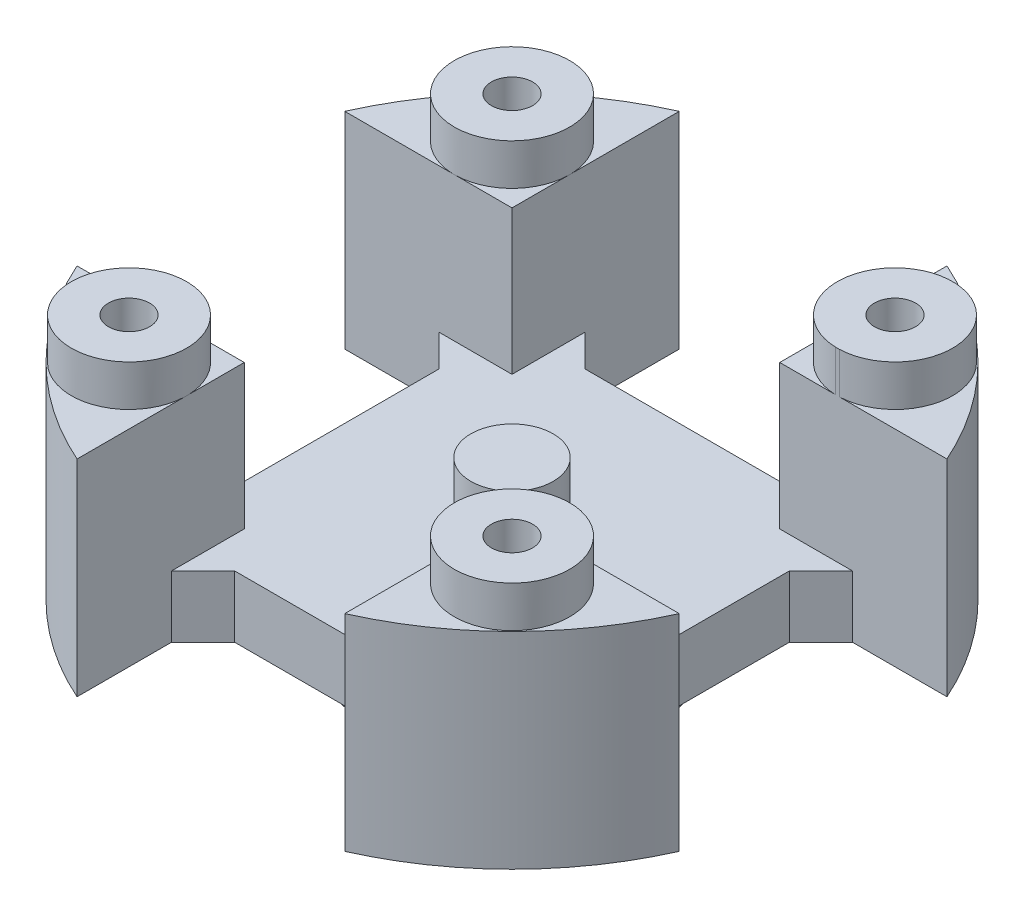
from build123d import *

# Parameters (mm, degrees)
CROQUIS1_R                 = 16
SALIENTE_EXTRUIR1_DEPTH    = 10
CORTAR_EXTRUIR2_DEPTH      = 10
CORTAR_EXTRUIR4_DEPTH      = 7
CORTAR_EXTRUIR4_DEPTH_BACK = 10
CORTAR_EXTRUIR4_START      = -10
CROQUIS5_R                 = 2
SALIENTE_EXTRUIR2_DEPTH    = 3
CROQUIS6_R                 = 2.8
CROQUIS6_R_2               = 1
SALIENTE_EXTRUIR4_DEPTH    = 2
CORTAR_EXTRUIR5_START      = -12
CROQUIS9_R                 = 1
CORTAR_EXTRUIR5_DEPTH      = 12
CROQUIS10_R                = 6.75
SALIENTE_EXTRUIR5_DEPTH    = 2
CROQUIS11_R                = 6
CORTAR_EXTRUIR6_DEPTH      = 4
CROQUIS12_R                = 0.375
CORTAR_EXTRUIR7_DEPTH      = 7


with BuildPart() as part:
    # Croquis1 → Saliente-Extruir1 (new body)
    with BuildSketch(Plane(origin=(0, 0, 0), x_dir=(1, 0, 0), z_dir=(0, 1, 0))):
        with Locations(Location((0, 0, 0), (0, 0, 270))):
            Circle(CROQUIS1_R)
    extrude(amount=SALIENTE_EXTRUIR1_DEPTH)

    # Croquis2 → Cortar-Extruir2 (cut)
    with BuildSketch(Plane(origin=(0, 0, 0), x_dir=(-1, 0, 0), z_dir=(0, -1, 0))):
        with BuildLine():
            ThreePointArc((-6.5, -14.620191518), (0, -16), (6.5, -14.620191517))
            Line((6.5, -14.620191517), (6.5, -10.035533906))
            Line((6.5, -10.035533906), (4.964466094, -8.5))
            Line((4.964466094, -8.5), (-4.964466094, -8.5))
            Line((-4.964466094, -8.5), (-6.5, -10.035533906))
            Line((-6.5, -10.035533906), (-6.5, -14.620191517))
        make_face()
        with BuildLine():
            Line((-4.964466094, 8.5), (4.964466094, 8.5))
            Line((4.964466094, 8.5), (6.5, 10.035533906))
            Line((6.5, 10.035533906), (6.5, 14.620191517))
            ThreePointArc((6.5, 14.620191518), (0, 16.000000001), (-6.5, 14.620191518))
            Line((-6.5, 14.620191517), (-6.5, 10.035533906))
            Line((-6.5, 10.035533906), (-4.964466094, 8.5))
        make_face()
        with BuildLine():
            Line((10.035533906, -6.5), (14.620191517, -6.5))
            ThreePointArc((14.620191515, -6.499999999), (15.651246979, -3.322418977), (15.999999994, 0))
            ThreePointArc((16, 0), (15.651246984, 3.322418978), (14.620191517, 6.5))
            Line((14.620191517, 6.5), (10.035533906, 6.5))
            Line((10.035533906, 6.5), (8.5, 4.964466094))
            Line((8.5, 4.964466094), (8.5, -4.964466094))
            Line((8.5, -4.964466094), (10.035533906, -6.5))
        make_face()
        with BuildLine():
            ThreePointArc((-14.620191518, 6.5), (-16.000000001, 0), (-14.620191518, -6.5))
            Line((-14.620191517, -6.5), (-10.035533906, -6.5))
            Line((-10.035533906, -6.5), (-8.5, -4.964466094))
            Line((-8.5, -4.964466094), (-8.5, 4.964466094))
            Line((-8.5, 4.964466094), (-10.035533906, 6.5))
            Line((-10.035533906, 6.5), (-14.620191517, 6.5))
        make_face()
    extrude(amount=-CORTAR_EXTRUIR2_DEPTH, mode=Mode.SUBTRACT)

    # Croquis4 → Cortar-Extruir4 (cut, two sides: drawn at the far end of the back side and taken through both)
    with BuildSketch(Plane.XZ.offset(CORTAR_EXTRUIR4_START - CORTAR_EXTRUIR4_DEPTH_BACK)):
        Polygon((-6.5, 16.599431938), (-6.5, 6.5), (-19.32076002, 6.5), (-19.32076002, -6.5), (-6.5, -6.5), (-6.5, -17.296221808), (6.5, -17.296221808), (6.5, -6.5), (20.964302933, -6.5), (20.964302933, 6.5), (6.5, 6.5), (6.5, 16.599431938), align=None)
    extrude(amount=CORTAR_EXTRUIR4_DEPTH + CORTAR_EXTRUIR4_DEPTH_BACK, mode=Mode.SUBTRACT)

    # Croquis5 → Saliente-Extruir2 (add)
    with BuildSketch(Plane(origin=(0, 3, 0), x_dir=(1, 0, 0), z_dir=(0, 1, 0))):
        with Locations(Location((0, 0, 0), (0, 0, 270))):
            Circle(CROQUIS5_R)
    extrude(amount=SALIENTE_EXTRUIR2_DEPTH)

    # Croquis6 → Saliente-Extruir4 (add)
    # profile 1 of 4: a face of its own
    with BuildSketch(Plane(origin=(0, 10, 0), x_dir=(1, 0, 0), z_dir=(0, 1, 0))):
        with Locations(Location((-9.298454173, -9.298454173, 0), (0, 0, 88.096034402))):
            Circle(CROQUIS6_R)
        with Locations(Location((-9.298454173, -9.298454173, 0), (0, 0, 270))):
            Circle(CROQUIS6_R_2, mode=Mode.SUBTRACT)
    # profile 2 of 4: a face of its own
    with BuildSketch(Plane(origin=(0, 10, 0), x_dir=(1, 0, 0), z_dir=(0, 1, 0))):
        with Locations(Location((-9.298454173, 9.298454173, 0), (0, 0, 1.903965598))):
            Circle(CROQUIS6_R)
        with Locations(Location((-9.298454173, 9.298454173, 0), (0, 0, 270))):
            Circle(CROQUIS6_R_2, mode=Mode.SUBTRACT)
    # profile 3 of 4: a face of its own
    with BuildSketch(Plane(origin=(0, 10, 0), x_dir=(1, 0, 0), z_dir=(0, 1, 0))):
        with BuildLine():
            ThreePointArc((9.391482361, 6.5), (11.310974847, 7.351723442), (12.098454173, 9.298454173))
            ThreePointArc((12.098454173, 9.298454173), (9.344974688, 12.098067689), (6.5, 9.391482361))
            Line((6.5, 9.391482361), (6.5, 9.205425984))
            ThreePointArc((6.5, 9.205425984), (7.318555185, 7.318555185), (9.205425984, 6.5))
            Line((9.205425984, 6.5), (9.391482361, 6.5))
        make_face()
        with Locations(Location((9.298454173, 9.298454173, 0), (0, 0, 270))):
            Circle(CROQUIS6_R_2, mode=Mode.SUBTRACT)
    # profile 4 of 4: a face of its own
    with BuildSketch(Plane(origin=(0, 10, 0), x_dir=(1, 0, 0), z_dir=(0, 1, 0))):
        with Locations(Location((9.298454173, -9.298454173, 0), (0, 0, 91.903965598))):
            Circle(CROQUIS6_R)
        with Locations(Location((9.298454173, -9.298454173, 0), (0, 0, 270))):
            Circle(CROQUIS6_R_2, mode=Mode.SUBTRACT)
    extrude(amount=SALIENTE_EXTRUIR4_DEPTH)

    # Croquis9 → Cortar-Extruir5 (cut)
    with BuildSketch(Plane(origin=(0, 10, 0), x_dir=(1, 0, 0), z_dir=(0, 1, 0)).offset(CORTAR_EXTRUIR5_START)):
        with Locations(Location((-9.298454173, 9.298454173, 0), (0, 0, 270))):
            Circle(CROQUIS9_R)
        with Locations(Location((9.298454173, 9.298454173, 0), (0, 0, 270))):
            Circle(CROQUIS9_R)
        with Locations(Location((9.298454173, -9.298454173, 0), (0, 0, 270))):
            Circle(CROQUIS9_R)
        with Locations(Location((-9.298454173, -9.298454173, 0), (0, 0, 270))):
            Circle(CROQUIS9_R)
    extrude(amount=CORTAR_EXTRUIR5_DEPTH, mode=Mode.SUBTRACT)

    # Croquis10 → Saliente-Extruir5 (add)
    with BuildSketch(Plane.XZ):
        with Locations(Location((0, 0, 0), (0, 0, 90))):
            Circle(CROQUIS10_R)
    extrude(amount=SALIENTE_EXTRUIR5_DEPTH)

    # Croquis11 → Cortar-Extruir6 (cut)
    with BuildSketch(Plane.XZ.offset(2)):
        with Locations(Location((0, 0, 0), (0, 0, 270))):
            Circle(CROQUIS11_R)
    extrude(amount=-CORTAR_EXTRUIR6_DEPTH, mode=Mode.SUBTRACT)

    # Croquis12 → Cortar-Extruir7 (cut)
    with BuildSketch(Plane.XZ.offset(2)):
        with Locations(Location((0, 0, 0), (0, 0, 270))):
            Circle(CROQUIS12_R)
    extrude(amount=-CORTAR_EXTRUIR7_DEPTH, mode=Mode.SUBTRACT)


solid = part.part
